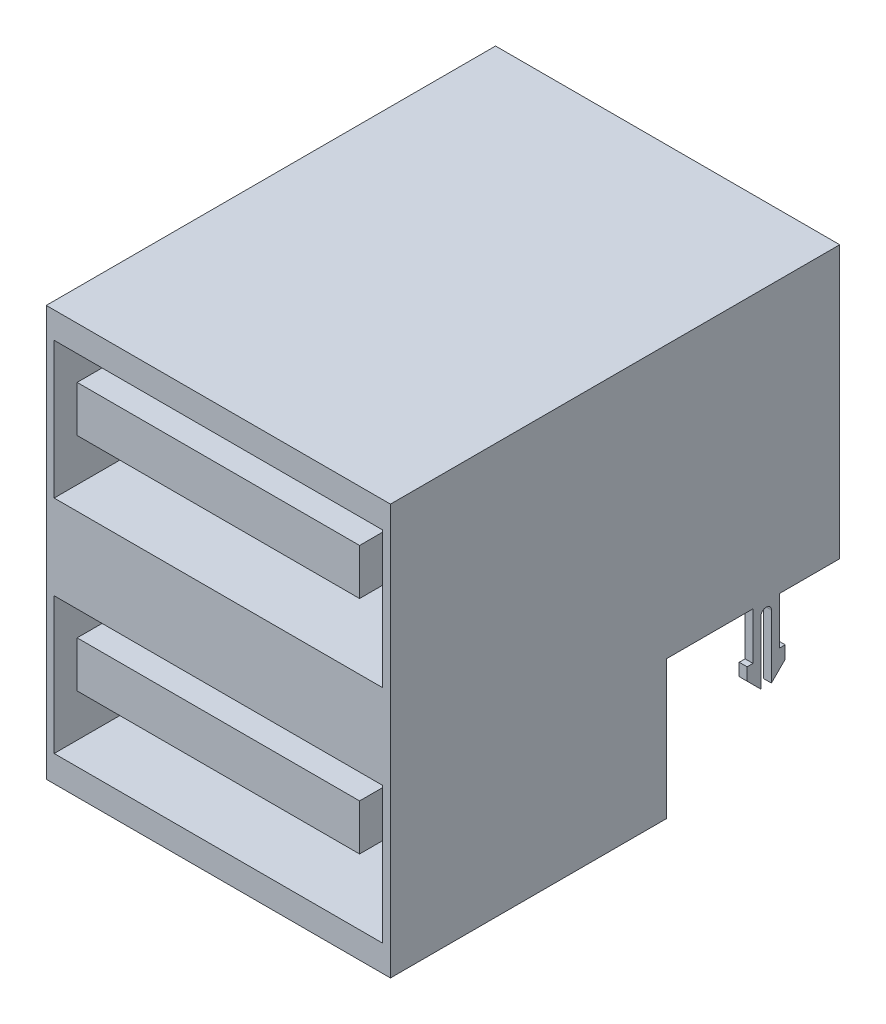
from build123d import *

# Parameters (mm, degrees)
BOSS_EXTRUDE1_DEPTH      = 6.55
BOSS_EXTRUDE1_DEPTH_BACK = 6.55
SKETCH2_W                = 12.5
SKETCH2_H                = 5.2
SKETCH2_W_2              = 10.75
SKETCH2_H_2              = 1.75
CUT_EXTRUDE1_DEPTH       = 9.5
BOSS_EXTRUDE2_DEPTH      = 0.3


with BuildPart() as part:
    # Sketch1 → Boss-Extrude1 (new, two sides: drawn at the far end of the back side and taken through both)
    with BuildSketch(Plane(origin=(0, 0, 0), x_dir=(0, 0, -1), z_dir=(1, 0, 0)).offset(-BOSS_EXTRUDE1_DEPTH_BACK)):
        Polygon((-10.5, 10.35), (6.6, 10.35), (6.6, 0), (0, 0), (0, -5.27), (-10.5, -5.27), align=None)
    extrude(amount=BOSS_EXTRUDE1_DEPTH + BOSS_EXTRUDE1_DEPTH_BACK)

    # Sketch2 → Cut-Extrude1 (cut)
    # profile 1 of 2: a face of its own
    with BuildSketch(Plane.XY.offset(10.5)):
        with Locations((0, 6.75)):
            Rectangle(SKETCH2_W, SKETCH2_H)
        with Locations((0, 7.525)):
            Rectangle(SKETCH2_W_2, SKETCH2_H_2, mode=Mode.SUBTRACT)
    # profile 2 of 2: a face of its own
    with BuildSketch(Plane.XY.offset(10.5)):
        with Locations((0, -1.67)):
            Rectangle(SKETCH2_W, SKETCH2_H)
        with Locations((0, -0.895)):
            Rectangle(SKETCH2_W_2, SKETCH2_H_2, mode=Mode.SUBTRACT)
    extrude(amount=-CUT_EXTRUDE1_DEPTH, mode=Mode.SUBTRACT)

    # Sketch3 → Boss-Extrude2 (add)
    with BuildSketch(Plane(origin=(6.55, 0, 0), x_dir=(0, 0, -1), z_dir=(1, 0, 0))):
        with BuildLine():
            Line((3.6, -2.8), (3.075, -2.275))
            Line((3.075, -2.275), (3.075, -1.8))
            Line((3.075, -1.8), (3.3, -1.8))
            Line((3.3, -1.8), (3.3, 0))
            Line((3.3, 0), (4.3, 0))
            Line((4.3, 0), (4.3, -1.8))
            Line((4.3, -1.8), (4.525, -1.8))
            Line((4.525, -1.8), (4.525, -2.275))
            Line((4.525, -2.275), (4, -2.8))
            Line((4, -2.8), (4, -0.395))
            ThreePointArc((4, -0.395), (3.942885822, -0.257114178), (3.805, -0.2))
            Line((3.805, -0.2), (3.795, -0.2))
            ThreePointArc((3.795, -0.2), (3.657114178, -0.257114178), (3.6, -0.395))
            Line((3.6, -0.395), (3.6, -2.8))
        make_face()
    boss_extrude2 = extrude(amount=-BOSS_EXTRUDE2_DEPTH)

    # Mirror1: Boss-Extrude2 across plane
    add(boss_extrude2.mirror(Plane(origin=(0, 0, 0), x_dir=(0, 0, 1), z_dir=(1, 0, 0))))


solid = part.part
